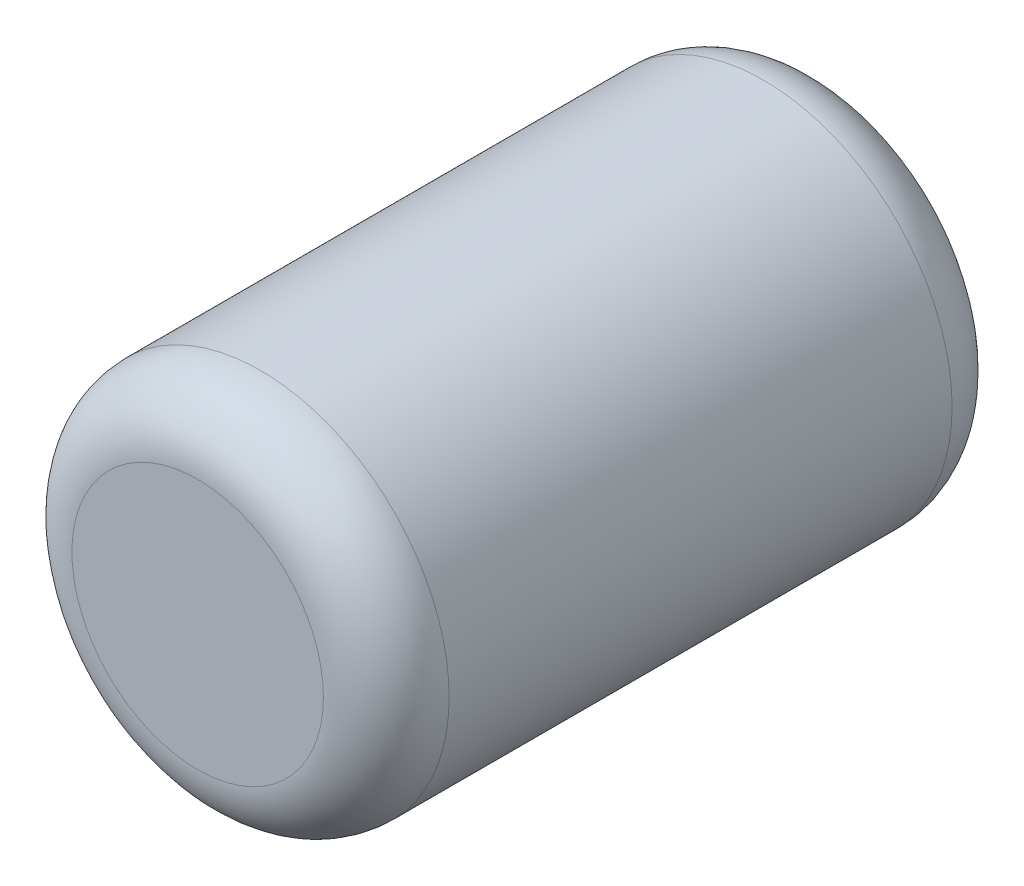
from build123d import *

# Parameters (mm, degrees)
SKETCH_1_R      = 1.5
EXTRUDE_1_DEPTH = 5
FILLET_1_R      = 0.5


with BuildPart() as part:
    # 草图1 → 凸台-拉伸1 (new body)
    with BuildSketch(Plane.XY):
        Circle(SKETCH_1_R)
    extrude(amount=EXTRUDE_1_DEPTH)

    # 圆角1
    fillet_1_edges = [part.edges().sort_by_distance(p)[0] for p in [
        (-1.5, 0, 0),
        (-1.5, 0, 5),
    ]]
    fillet(fillet_1_edges, radius=FILLET_1_R)


solid = part.part
